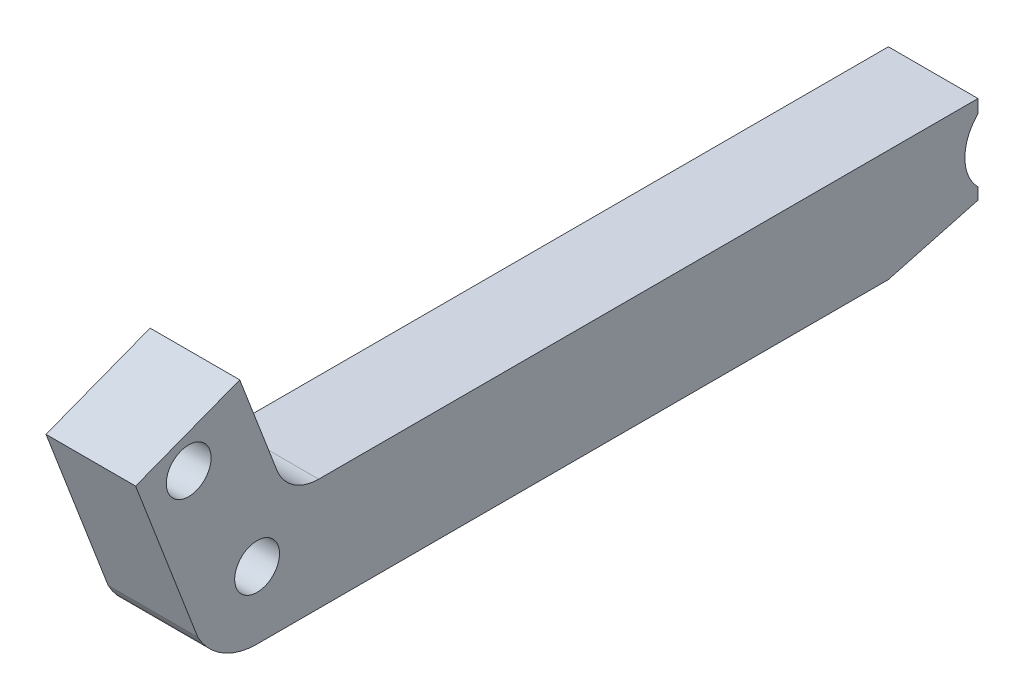
from build123d import *

# Parameters (mm, degrees)
SKETCH_1_R          = 2.5
EXTRUDE_1_DEPTH     = 10
FILLET_1_R          = 5
CUT_EXTRUDE_1_REACH = 85.254
SKETCH_2_R          = 2.5
CHAMFER_1_SIZE      = 10
CHAMFER_1_SIZE2     = 2.679491924


with BuildPart() as part:
    # 草圖1 → 填料-伸長1 (new body)
    with BuildSketch(Plane(origin=(0, 0, 0), x_dir=(0, 0, -1), z_dir=(1, 0, 0))):
        with BuildLine():
            Line((0, -7.5), (80.436404793, -7.5))
            Line((80.436404793, -7.5), (80.436404793, -3.535533906))
            ThreePointArc((80.436404793, -3.535533906), (78.971938699, 0), (80.436404793, 3.535533906))
            Line((80.436404793, 3.535533906), (80.436404793, 5))
            Line((80.436404793, 5), (3.436404793, 5))
            Line((3.436404793, 5), (-1.93911445, 19.003706397))
            Line((-1.93911445, 19.003706397), (-13.554844706, 14.544845311))
            Line((-13.554844706, 14.544845311), (-6.614588023, -3.535141479))
            ThreePointArc((-6.614588023, -3.535141479), (-3.85593302, -6.43286721), (0, -7.5))
        make_face()
        Circle(SKETCH_1_R, mode=Mode.SUBTRACT)
    extrude(amount=EXTRUDE_1_DEPTH)

    # 圓角1
    fillet_1_edges = [part.edges().sort_by_distance(p)[0] for p in [
        (5, 5, -3.436404793),
    ]]
    fillet(fillet_1_edges, radius=FILLET_1_R)

    # 草圖2 → 除料-伸長1 (cut, up to next)
    with BuildSketch(Plane.ZY, mode=Mode.PRIVATE) as cut_extrude_1_sk1:
        with Locations((7.632654751, 13.069153566)):
            Circle(SKETCH_2_R)
    cut_extrude_1_tool1 = extrude(cut_extrude_1_sk1.sketch, amount=-CUT_EXTRUDE_1_REACH, mode=Mode.PRIVATE) & part.part
    add(cut_extrude_1_tool1.solids().sort_by_distance((0, 13.069154, 7.632655))[0], mode=Mode.SUBTRACT)

    # 導角1
    chamfer_1_edges = [part.edges().sort_by_distance(p)[0] for p in [
        (5, -7.5, -80.436404793),
    ]]
    chamfer_1_side = [part.faces().sort_by_distance(p)[0] for p in [
        (5, -7.5, -40.218202397),
    ]]
    chamfer(chamfer_1_edges, length=CHAMFER_1_SIZE, length2=CHAMFER_1_SIZE2, reference=chamfer_1_side[0])


solid = part.part
